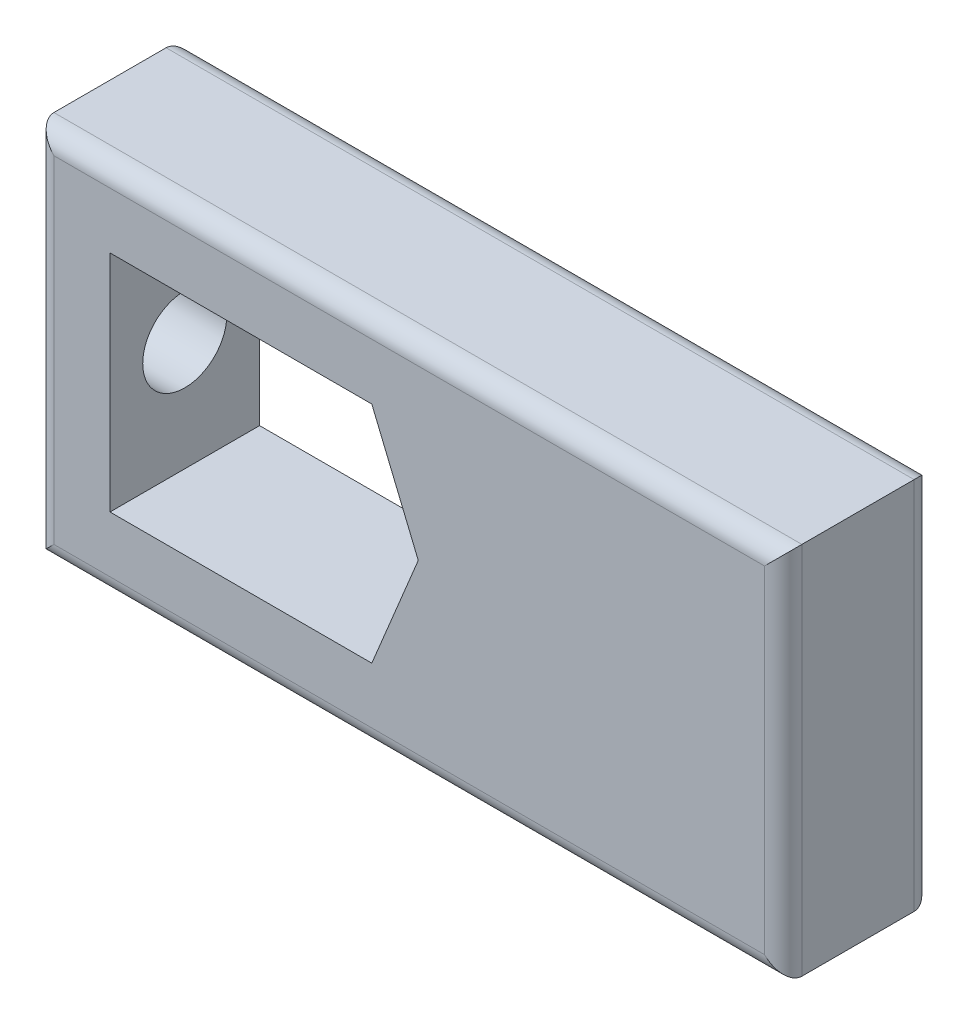
from build123d import *

# Parameters (mm, degrees)
SKICA1_W                 = 40
SKICA1_H                 = 20
P_IDAT_VYSUNUT_M1_DEPTH  = 8
SKICA2_R                 = 2.25
ODEBRAT_VYSUNUT_M1_DEPTH = 8
ZAOBLIT2_R               = 1
ZAOBLIT3_R               = 1


with BuildPart() as part:
    # Skica1 → Přidat vysunutím1 (new body)
    with BuildSketch(Plane.XY):
        with Locations((20, 10)):
            Rectangle(SKICA1_W, SKICA1_H)
        Polygon((4, 16), (4, 4), (18, 4), (20.485281374, 10), (18, 16), align=None, mode=Mode.SUBTRACT)
    extrude(amount=P_IDAT_VYSUNUT_M1_DEPTH)

    # Skica2 → Odebrat vysunutím1 (cut)
    with BuildSketch(Plane.ZY):
        with Locations((4, 10)):
            Circle(SKICA2_R)
    extrude(amount=-ODEBRAT_VYSUNUT_M1_DEPTH, mode=Mode.SUBTRACT)

    # Zaoblit2
    zaoblit2_edges = [part.edges().sort_by_distance(p)[0] for p in [
        (20, 20, 8),
        (0, 10, 8),
        (20, 0, 8),
        (40, 10, 8),
    ]]
    fillet(zaoblit2_edges, radius=ZAOBLIT2_R)

    # Zaoblit3
    zaoblit3_edges = [part.edges().sort_by_distance(p)[0] for p in [
        (0, 10, 0),
        (20, 20, 0),
        (40, 10, 0),
        (20, 0, 0),
    ]]
    fillet(zaoblit3_edges, radius=ZAOBLIT3_R)


solid = part.part
